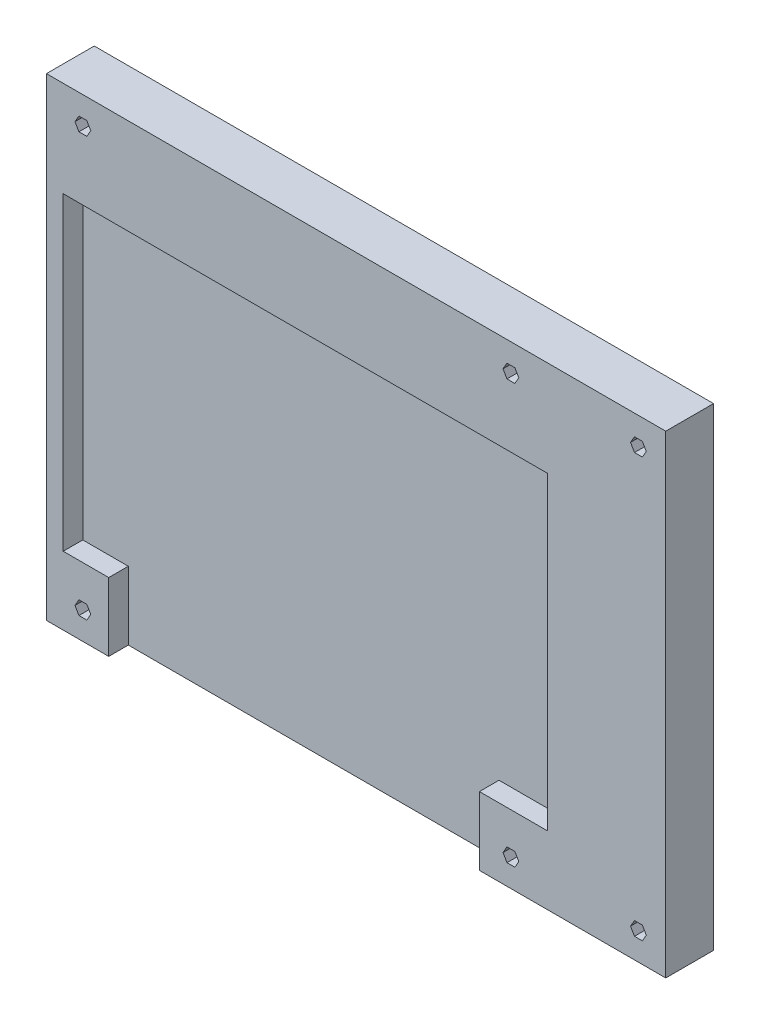
from build123d import *

# Parameters (mm, degrees)
SKETCH_1_W             = 136
SKETCH_1_H             = 104
EXTRUDE_1_DEPTH        = 10.5
CUT_EXTRUDE_1428_DEPTH = 4.3
CUT_EXTRUDE_1765_REACH = 173.529
SKETCH_4_W             = 15
SKETCH_4_H             = 35
CUT_EXTRUDE_3_DEPTH    = 3


with BuildPart() as part:
    # 草图1 → 凸台-拉伸1 (new body)
    with BuildSketch(Plane.XY):
        with Locations((68, 52)):
            Rectangle(SKETCH_1_W, SKETCH_1_H)
    extrude(amount=-EXTRUDE_1_DEPTH)

    # 草图1<3> → Cut-Extrude 1428 (cut)
    with BuildSketch(Plane.XY):
        Polygon((13.68, 15), (13.68, 0), (95.08, 0), (95.08, 15), (110.08, 15), (110.08, 83), (3.68, 83), (3.68, 15), align=None)
    extrude(amount=-CUT_EXTRUDE_1428_DEPTH, mode=Mode.SUBTRACT)

    # 草图1<5> → Cut-Extrude 1765 (cut, up to next)
    with BuildSketch(Plane.XY, mode=Mode.PRIVATE) as cut_extrude_1765_sk1:
        Polygon((8.866025404, 4.5), (9.732050808, 6), (8.866025404, 7.5), (7.133974596, 7.5), (6.267949192, 6), (7.133974596, 4.5), align=None)
    cut_extrude_1765_tool1 = extrude(cut_extrude_1765_sk1.sketch, amount=-CUT_EXTRUDE_1765_REACH, mode=Mode.PRIVATE) & part.part
    # 草图1<5> → Cut-Extrude 1765 (cut, up to next)
    with BuildSketch(Plane.XY, mode=Mode.PRIVATE) as cut_extrude_1765_sk2:
        Polygon((129.133974596, 7.5), (128.267949192, 6), (129.133974596, 4.5), (130.866025404, 4.5), (131.732050808, 6), (130.866025404, 7.5), align=None)
    cut_extrude_1765_tool2 = extrude(cut_extrude_1765_sk2.sketch, amount=-CUT_EXTRUDE_1765_REACH, mode=Mode.PRIVATE) & part.part
    # 草图1<5> → Cut-Extrude 1765 (cut, up to next)
    with BuildSketch(Plane.XY, mode=Mode.PRIVATE) as cut_extrude_1765_sk3:
        Polygon((130.866025404, 96.5), (131.732050808, 98), (130.866025404, 99.5), (129.133974596, 99.5), (128.267949192, 98), (129.133974596, 96.5), align=None)
    cut_extrude_1765_tool3 = extrude(cut_extrude_1765_sk3.sketch, amount=-CUT_EXTRUDE_1765_REACH, mode=Mode.PRIVATE) & part.part
    # 草图1<5> → Cut-Extrude 1765 (cut, up to next)
    with BuildSketch(Plane.XY, mode=Mode.PRIVATE) as cut_extrude_1765_sk4:
        Polygon((8.866025404, 96.5), (9.732050808, 98), (8.866025404, 99.5), (7.133974596, 99.5), (6.267949192, 98), (7.133974596, 96.5), align=None)
    cut_extrude_1765_tool4 = extrude(cut_extrude_1765_sk4.sketch, amount=-CUT_EXTRUDE_1765_REACH, mode=Mode.PRIVATE) & part.part
    # 草图1<5> → Cut-Extrude 1765 (cut, up to next)
    with BuildSketch(Plane.XY, mode=Mode.PRIVATE) as cut_extrude_1765_sk5:
        Polygon((102.866025404, 99.5), (101.133974596, 99.5), (100.267949192, 98), (101.133974596, 96.5), (102.866025404, 96.5), (103.732050808, 98), align=None)
    cut_extrude_1765_tool5 = extrude(cut_extrude_1765_sk5.sketch, amount=-CUT_EXTRUDE_1765_REACH, mode=Mode.PRIVATE) & part.part
    # 草图1<5> → Cut-Extrude 1765 (cut, up to next)
    with BuildSketch(Plane.XY, mode=Mode.PRIVATE) as cut_extrude_1765_sk6:
        Polygon((102.866025404, 4.5), (103.732050808, 6), (102.866025404, 7.5), (101.133974596, 7.5), (100.267949192, 6), (101.133974596, 4.5), align=None)
    cut_extrude_1765_tool6 = extrude(cut_extrude_1765_sk6.sketch, amount=-CUT_EXTRUDE_1765_REACH, mode=Mode.PRIVATE) & part.part
    add(cut_extrude_1765_tool1.solids().sort_by_distance((8, 6, 0))[0], mode=Mode.SUBTRACT)
    add(cut_extrude_1765_tool2.solids().sort_by_distance((130, 6, 0))[0], mode=Mode.SUBTRACT)
    add(cut_extrude_1765_tool3.solids().sort_by_distance((130, 98, 0))[0], mode=Mode.SUBTRACT)
    add(cut_extrude_1765_tool4.solids().sort_by_distance((8, 98, 0))[0], mode=Mode.SUBTRACT)
    add(cut_extrude_1765_tool5.solids().sort_by_distance((102, 98, 0))[0], mode=Mode.SUBTRACT)
    add(cut_extrude_1765_tool6.solids().sort_by_distance((102, 6, 0))[0], mode=Mode.SUBTRACT)

    # 草图4 → 切除-拉伸3 (cut)
    with BuildSketch(Plane(origin=(0, 0, -10.5), x_dir=(-1, 0, 0), z_dir=(0, 0, -1))):
        with Locations((-12.767949192, 27)):
            Rectangle(SKETCH_4_W, SKETCH_4_H)
    extrude(amount=-CUT_EXTRUDE_3_DEPTH, mode=Mode.SUBTRACT)


solid = part.part
